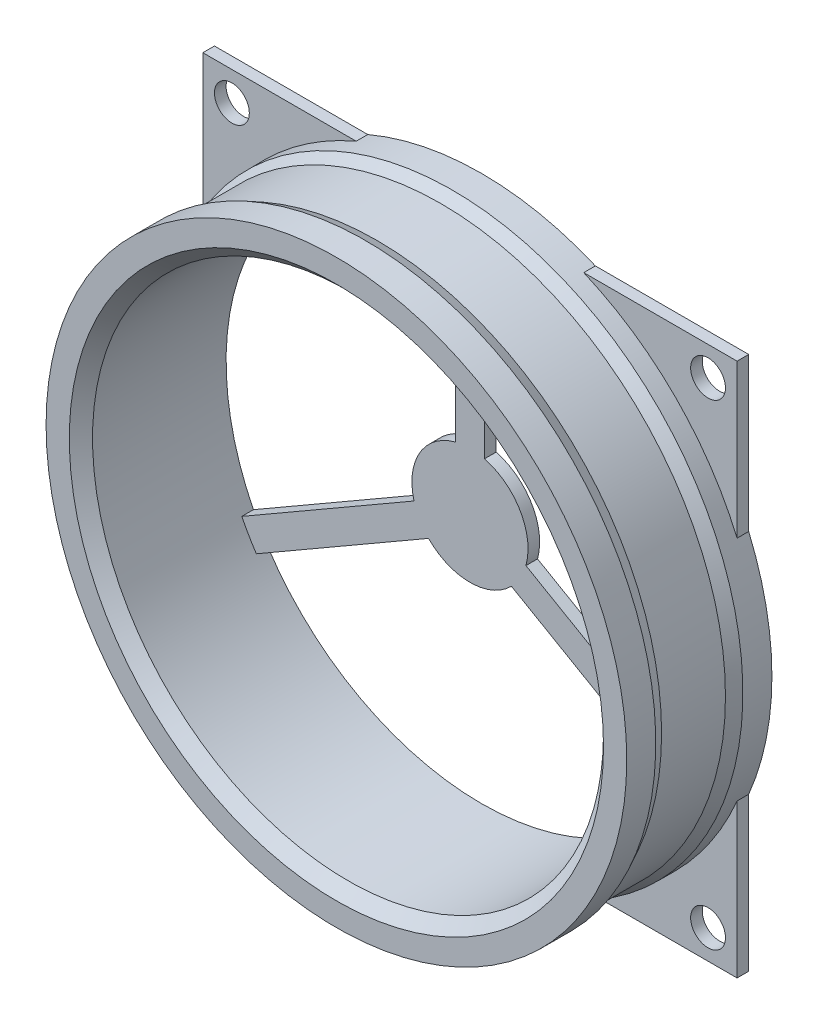
from build123d import *

# Parameters (mm, degrees)
SALIENTE_EXTRUIR2_DEPTH   = 2
SALIENTE_EXTRUIR2_2_DEPTH = 2
SALIENTE_EXTRUIR2_3_DEPTH = 2
SALIENTE_EXTRUIR2_4_DEPTH = 2
SALIENTE_EXTRUIR2_5_DEPTH = 2
SALIENTE_EXTRUIR3_DEPTH   = 25
CHAFL_N1_SIZE             = 2
CROQUIS3_R                = 3
CORTAR_EXTRUIR1_DEPTH     = 25


with BuildPart() as part:
    # Croquis1 → Saliente-Extruir2 (new body)
    with BuildSketch(Plane.XY):
        with BuildLine():
            ThreePointArc((-19.595917942, -46), (-35.355339059, -35.355339059), (-46, -19.595917942))
            Line((-46, -19.595917942), (-46, -46))
            Line((-46, -46), (-19.595917942, -46))
        make_face()
    extrude(amount=SALIENTE_EXTRUIR2_DEPTH)



with BuildPart() as body_2:
    # Croquis1 → Saliente-Extruir2 2 (new body)
    with BuildSketch(Plane.XY):
        with BuildLine():
            Line((-46, 46), (-46, 19.595917942))
            ThreePointArc((-46, 19.595917942), (-35.355339059, 35.355339059), (-19.595917942, 46))
            Line((-19.595917942, 46), (-46, 46))
        make_face()
    extrude(amount=SALIENTE_EXTRUIR2_2_DEPTH)


with BuildPart() as body_3:
    # Croquis1 → Saliente-Extruir2 3 (new body)
    with BuildSketch(Plane.XY):
        with BuildLine():
            ThreePointArc((46, -19.595917942), (35.355339059, -35.355339059), (19.595917942, -46))
            Line((19.595917942, -46), (46, -46))
            Line((46, -46), (46, -19.595917942))
        make_face()
    extrude(amount=SALIENTE_EXTRUIR2_3_DEPTH)


with BuildPart() as body_4:
    # Croquis1 → Saliente-Extruir2 4 (new body)
    with BuildSketch(Plane.XY):
        with BuildLine():
            Line((46, 46), (19.595917942, 46))
            ThreePointArc((19.595917942, 46), (35.355339059, 35.355339059), (46, 19.595917942))
            Line((46, 19.595917942), (46, 46))
        make_face()
    extrude(amount=SALIENTE_EXTRUIR2_4_DEPTH)


with BuildPart() as body_5:
    # Croquis1 → Saliente-Extruir2 5 (new body)
    with BuildSketch(Plane.XY):
        with BuildLine():
            Line((-2.5, 43.928919859), (-2.5, 9.682458366))
            ThreePointArc((-2.5, 9.682458366), (-8.660254038, 5), (-9.635254916, -2.676165673))
            Line((-9.635254916, -2.676165673), (-39.293560559, -19.79939642))
            ThreePointArc((-39.293560559, -19.79939642), (-38.105117767, -22), (-36.793560559, -24.129523439))
            Line((-36.793560559, -24.129523439), (-7.135254916, -7.006292692))
            ThreePointArc((-7.135254916, -7.006292692), (0, -10), (7.135254916, -7.006292692))
            Line((7.135254916, -7.006292692), (36.793560559, -24.129523439))
            ThreePointArc((36.793560559, -24.129523439), (38.105117767, -22), (39.293560559, -19.79939642))
            Line((39.293560559, -19.79939642), (9.635254916, -2.676165673))
            ThreePointArc((9.635254916, -2.676165673), (8.660254038, 5), (2.5, 9.682458366))
            Line((2.5, 9.682458366), (2.5, 43.928919859))
            ThreePointArc((2.5, 43.928919859), (0, 44), (-2.5, 43.928919859))
        make_face()
    extrude(amount=SALIENTE_EXTRUIR2_5_DEPTH)


with BuildPart() as part_1:
    add(part.part)

    add(body_2.part)  # Saliente-Extruir3 merges body 2

    add(body_3.part)  # Saliente-Extruir3 merges body 3

    add(body_4.part)  # Saliente-Extruir3 merges body 4

    add(body_5.part)  # Saliente-Extruir3 merges body 5
    # Croquis1<5> → Saliente-Extruir3 (add)
    with BuildSketch(Plane.XY):
        with BuildLine():
            ThreePointArc((-46, 19.595917942), (-50, 0), (-46, -19.595917942))
            ThreePointArc((-46, -19.595917942), (-35.355339059, -35.355339059), (-19.595917942, -46))
            ThreePointArc((-19.595917942, -46), (0, -50), (19.595917942, -46))
            ThreePointArc((19.595917942, -46), (35.355339059, -35.355339059), (46, -19.595917942))
            ThreePointArc((46, -19.595917942), (48.989794856, -10), (50, 0))
            ThreePointArc((50, 0), (48.989794856, 10), (46, 19.595917942))
            ThreePointArc((46, 19.595917942), (35.355339059, 35.355339059), (19.595917942, 46))
            ThreePointArc((19.595917942, 46), (0, 50), (-19.595917942, 46))
            ThreePointArc((-19.595917942, 46), (-35.355339059, 35.355339059), (-46, 19.595917942))
        make_face()
        with BuildLine():
            ThreePointArc((-39.293560559, -19.79939642), (-38.105117767, 22), (-2.5, 43.928919859))
            ThreePointArc((-2.5, 43.928919859), (0, 44), (2.5, 43.928919859))
            ThreePointArc((2.5, 43.928919859), (31.984371183, 30.215889859), (44, 0))
            ThreePointArc((44, 0), (42.807222899, -10.175542625), (39.293560559, -19.79939642))
            ThreePointArc((39.293560559, -19.79939642), (38.105117767, -22), (36.793560559, -24.129523439))
            ThreePointArc((36.793560559, -24.129523439), (0, -44), (-36.793560559, -24.129523439))
            ThreePointArc((-36.793560559, -24.129523439), (-38.105117767, -22), (-39.293560559, -19.79939642))
        make_face(mode=Mode.SUBTRACT)
    extrude(amount=SALIENTE_EXTRUIR3_DEPTH)

    # Croquis2 → Cortar-Revolución1 (revolve, cut)
    with BuildSketch(Plane(origin=(0, 0, 0), x_dir=(0, 0, -1), z_dir=(1, 0, 0))):
        Polygon((-5, 50), (-20, 50), (-18, 49), (-7, 49), align=None)
    revolve(axis=Axis((0, 0, -1.25), (0, 0, 1)), mode=Mode.SUBTRACT)

    # Chaflán1
    chafl_n1_edges = [part_1.edges().sort_by_distance(p)[0] for p in [
        (36.793560559, 24.129523439, 25),
    ]]
    chamfer(chafl_n1_edges, length=CHAFL_N1_SIZE)

    # Croquis3 → Cortar-Extruir1 (cut)
    with BuildSketch(Plane.XY.offset(2)):
        with Locations((-41, 41)):
            Circle(CROQUIS3_R)
        with Locations((-41, -41)):
            Circle(CROQUIS3_R)
        with Locations((41, 41)):
            Circle(CROQUIS3_R)
        with Locations((41, -41)):
            Circle(CROQUIS3_R)
    extrude(amount=-CORTAR_EXTRUIR1_DEPTH, mode=Mode.SUBTRACT)


solid = part_1.part
